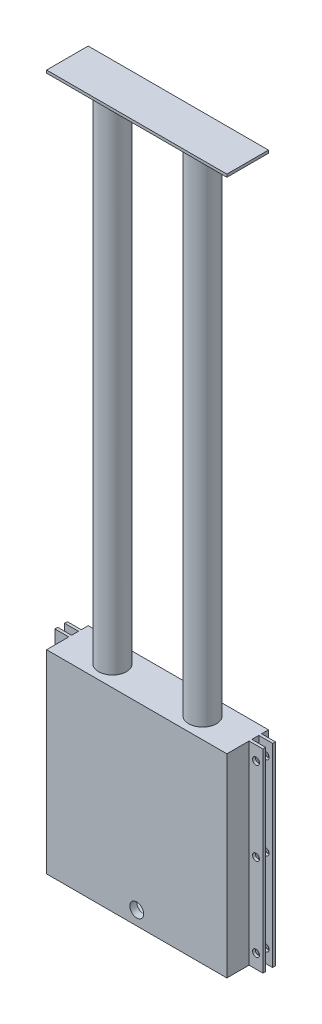
from build123d import *

# Parameters (mm, degrees)
BOSS_EXTRUDE1_DEPTH = 177.8
SKETCH2_W           = 12.7
SKETCH2_H           = 2.54
BOSS_EXTRUDE2_DEPTH = 177.8
SKETCH3_R           = 3.175
CUT_EXTRUDE1_DEPTH  = 203.727168628
SKETCH4_W           = 31.75
SKETCH4_H           = 6.35
BOSS_EXTRUDE3_DEPTH = 152.4
FILLET1_R           = 2.54
BOSS_EXTRUDE4_REACH = 251.919
SKETCH5_W           = 31.75
SKETCH5_H           = 6.35
BOSS_EXTRUDE5_DEPTH = 6.35
SKETCH7_W           = 25.4
SKETCH7_H           = 6.35
BOSS_EXTRUDE6_DEPTH = 12.7
SKETCH8_W           = 12.7
SKETCH8_H           = 6.35
REVOLVE1_ANGLE      = 180
SKETCH10_R          = 6.35
CUT_EXTRUDE2_DEPTH  = 206.273019416
SKETCH11_R          = 12.7
BOSS_EXTRUDE7_DEPTH = 457.2
BOSS_EXTRUDE8_DEPTH = 2.54
CUT_EXTRUDE3_DEPTH  = 646.740988406


with BuildPart() as part:
    # Sketch1 → Boss-Extrude1 (new body)
    with BuildSketch(Plane(origin=(0, 0, 0), x_dir=(1, 0, 0), z_dir=(0, 1, 0))):
        Polygon((76.2, 0), (82.55, 0), (82.55, 38.1), (-82.55, 38.1), (-82.55, 0), (-76.2, 0), (-76.2, 31.75), (76.2, 31.75), align=None)
    extrude(amount=BOSS_EXTRUDE1_DEPTH)

    # Sketch2 → Boss-Extrude2 (add)
    with BuildSketch(Plane(origin=(0, 177.8, 0), x_dir=(1, 0, 0), z_dir=(0, 1, 0))):
        with Locations((88.9, 30.48)):
            Rectangle(SKETCH2_W, SKETCH2_H)
        with Locations((88.9, 21.59)):
            Rectangle(SKETCH2_W, SKETCH2_H)
        with Locations((-88.9, 21.59)):
            Rectangle(SKETCH2_W, SKETCH2_H)
        with Locations((-88.9, 30.48)):
            Rectangle(SKETCH2_W, SKETCH2_H)
    extrude(amount=-BOSS_EXTRUDE2_DEPTH)

    # Sketch3 → Cut-Extrude1 (cut, through all)
    with BuildSketch(Plane.XY.offset(-20.32)):
        with Locations((88.9, 12.7)):
            Circle(SKETCH3_R)
        with Locations((88.9, 88.9)):
            Circle(SKETCH3_R)
        with Locations((88.9, 165.1)):
            Circle(SKETCH3_R)
        with Locations((-88.9, 12.7)):
            Circle(SKETCH3_R)
        with Locations((-88.9, 165.1)):
            Circle(SKETCH3_R)
        with Locations((-88.9, 88.9)):
            Circle(SKETCH3_R)
    extrude(amount=-CUT_EXTRUDE1_DEPTH, mode=Mode.SUBTRACT)

    # Sketch4 → Boss-Extrude3 (add)
    with BuildSketch(Plane(origin=(-76.2, 0, 0), x_dir=(0, 0, -1), z_dir=(1, 0, 0))):
        with Locations((15.875, 3.175)):
            Rectangle(SKETCH4_W, SKETCH4_H)
    extrude(amount=BOSS_EXTRUDE3_DEPTH)

    # Fillet1
    fillet1_edges = [part.edges().sort_by_distance(p)[0] for p in [
        (76.2, 6.35, -15.875),
        (0, 6.35, -31.75),
        (-76.2, 6.35, -15.875),
    ]]
    fillet(fillet1_edges, radius=FILLET1_R)

    # Sketch5 → Boss-Extrude4 (add, up to next)
    with BuildSketch(Plane(origin=(-76.2, 0, 0), x_dir=(0, 0, -1), z_dir=(1, 0, 0)), mode=Mode.PRIVATE) as boss_extrude4_sk1:
        with Locations((15.875, 174.625)):
            Rectangle(SKETCH5_W, SKETCH5_H)
    boss_extrude4_tool1 = extrude(boss_extrude4_sk1.sketch, amount=BOSS_EXTRUDE4_REACH, mode=Mode.PRIVATE) - part.part
    add(boss_extrude4_tool1.solids().sort_by_distance((-76.2, 174.625, -15.875))[0])

    # Sketch6 → Boss-Extrude5 (add)
    with BuildSketch(Plane.XY):
        with BuildLine():
            Line((76.2, 171.45), (76.2, 8.89))
            ThreePointArc((76.2, 8.89), (75.456051224, 7.093948776), (73.66, 6.35))
            Line((73.66, 6.35), (-73.66, 6.35))
            ThreePointArc((-73.66, 6.35), (-75.456051224, 7.093948776), (-76.2, 8.89))
            Line((-76.2, 8.89), (-76.2, 171.45))
            Line((-76.2, 171.45), (76.2, 171.45))
        make_face()
    extrude(amount=-BOSS_EXTRUDE5_DEPTH)

    # Sketch7 → Boss-Extrude6 (add)
    with BuildSketch(Plane.XZ):
        with Locations((0, -3.175)):
            Rectangle(SKETCH7_W, SKETCH7_H)
        with Locations((0, -34.925)):
            Rectangle(SKETCH7_W, SKETCH7_H)
    extrude(amount=BOSS_EXTRUDE6_DEPTH)

    # Sketch8 → Revolve1 (revolve)
    with BuildSketch(Plane.XZ.offset(12.7)):
        with Locations((6.35, -3.175)):
            Rectangle(SKETCH8_W, SKETCH8_H)
        with Locations((6.35, -34.925)):
            Rectangle(SKETCH8_W, SKETCH8_H)
    revolve(axis=Axis((0, -12.7, 0), (0, 0, -1)), revolution_arc=REVOLVE1_ANGLE)

    # Sketch10 → Cut-Extrude2 (cut, through all)
    with BuildSketch(Plane(origin=(0, 0, -38.1), x_dir=(-1, 0, 0), z_dir=(0, 0, -1))):
        with Locations((0, -12.7)):
            Circle(SKETCH10_R)
    cut_extrude2 = extrude(amount=-CUT_EXTRUDE2_DEPTH, mode=Mode.SUBTRACT)

    # Sketch11 → Boss-Extrude7 (add)
    with BuildSketch(Plane(origin=(0, 177.8, 0), x_dir=(1, 0, 0), z_dir=(0, 1, 0))):
        with Locations(Location((-41.275, 19.05, 0), (0, 0, 90))):
            Circle(SKETCH11_R)
        with Locations(Location((41.275, 19.05, 0), (0, 0, 90))):
            Circle(SKETCH11_R)
    extrude(amount=BOSS_EXTRUDE7_DEPTH)

    # Sketch12 → Boss-Extrude8 (add)
    with BuildSketch(Plane(origin=(0, 635, 0), x_dir=(1, 0, 0), z_dir=(0, 1, 0))):
        Polygon((82.55, 0), (82.55, 20.32), (82.55, 22.86), (82.55, 29.21), (82.55, 31.75), (82.55, 38.1), (-82.55, 38.1), (-82.55, 31.75), (-82.55, 29.21), (-82.55, 22.86), (-82.55, 20.32), (-82.55, 0), align=None)
    extrude(amount=BOSS_EXTRUDE8_DEPTH)

    # Mirror1: Cut-Extrude2 across plane
    add(cut_extrude2.mirror(Plane.ZX), mode=Mode.SUBTRACT)

    # Sketch13 → Cut-Extrude3 (cut, through all)
    with BuildSketch(Plane.XY):
        with BuildLine():
            Line((-12.7, 0), (12.7, 0))
            Line((12.7, 0), (12.7, -12.7))
            ThreePointArc((12.7, -12.7), (0, -25.4), (-12.7, -12.7))
            Line((-12.7, -12.7), (-12.7, 0))
        make_face()
    extrude(amount=-CUT_EXTRUDE3_DEPTH, mode=Mode.SUBTRACT)


solid = part.part
